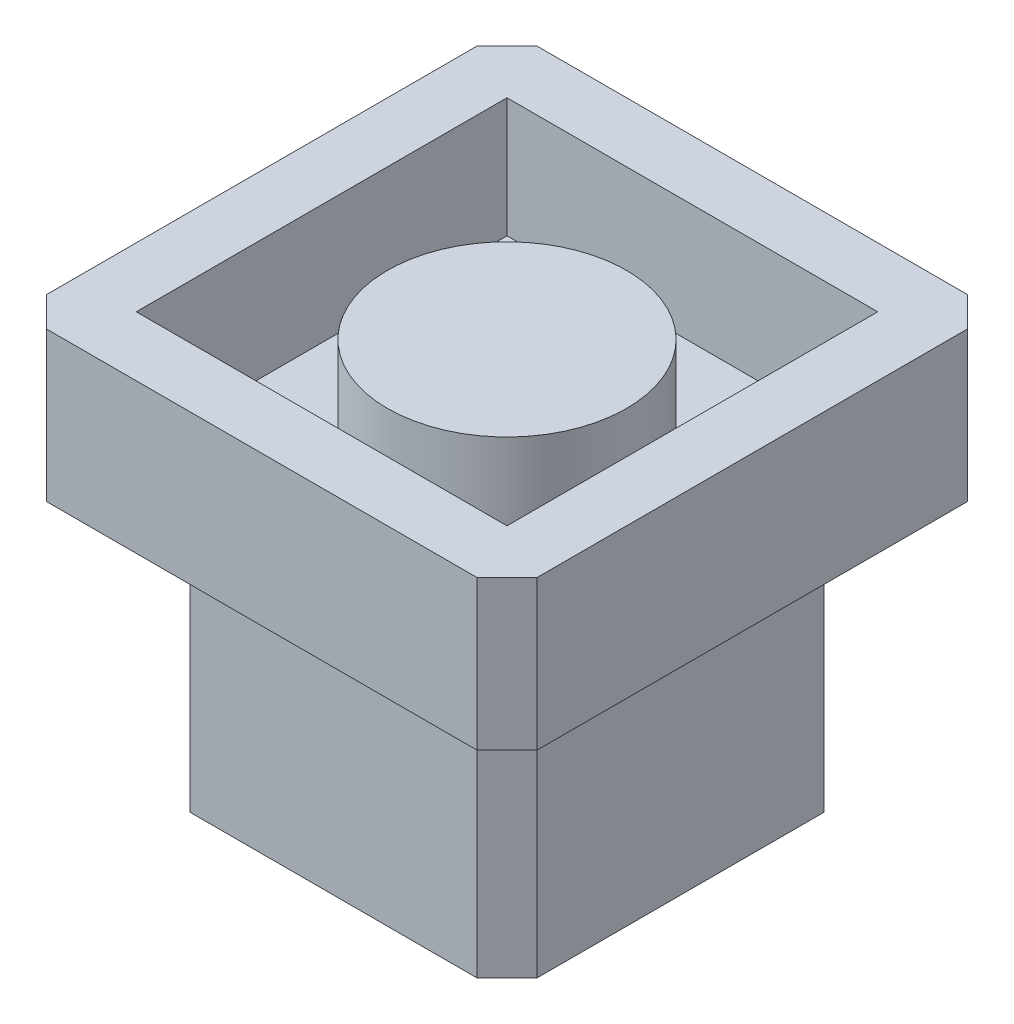
from build123d import *

# Parameters (mm, degrees)
SKETCH1_R           = 2
BOSS_EXTRUDE1_DEPTH = 1.6
SKETCH1_3_W         = 8.2
SKETCH1_3_H         = 8.2
SKETCH1_3_W_2       = 6.2
SKETCH1_3_H_2       = 6.2
BOSS_EXTRUDE2_DEPTH = 2
SKETCH1_4_W         = 8.2
SKETCH1_4_H         = 8.2
BOSS_EXTRUDE3_DEPTH = 0.5
SKETCH3_W           = 5.8
SKETCH3_H           = 5.8
BOSS_EXTRUDE4_DEPTH = 4.5
CHAMFER1_SIZE       = 0.5
CUT_EXTRUDE1_DEPTH  = 0.2


with BuildPart() as part:
    # Sketch1 → Boss-Extrude1 (new body)
    with BuildSketch(Plane(origin=(0, 0, 0), x_dir=(1, 0, 0), z_dir=(0, 1, 0))):
        Circle(SKETCH1_R)
    extrude(amount=BOSS_EXTRUDE1_DEPTH)



with BuildPart() as body_2:
    # Sketch1<3> → Boss-Extrude2 (new body)
    with BuildSketch(Plane(origin=(0, 0, 0), x_dir=(1, 0, 0), z_dir=(0, 1, 0))):
        Rectangle(SKETCH1_3_W, SKETCH1_3_H)
        Rectangle(SKETCH1_3_W_2, SKETCH1_3_H_2, mode=Mode.SUBTRACT)
    extrude(amount=BOSS_EXTRUDE2_DEPTH)


with BuildPart() as part_1:
    add(part.part)

    add(body_2.part)  # Boss-Extrude3 merges body 2
    # Sketch1<4> → Boss-Extrude3 (add)
    with BuildSketch(Plane(origin=(0, 0, 0), x_dir=(1, 0, 0), z_dir=(0, 1, 0))):
        Rectangle(SKETCH1_4_W, SKETCH1_4_H)
    extrude(amount=-BOSS_EXTRUDE3_DEPTH)

    # Sketch3 → Boss-Extrude4 (add)
    with BuildSketch(Plane.XZ.offset(0.5)):
        Rectangle(SKETCH3_W, SKETCH3_H)
    extrude(amount=BOSS_EXTRUDE4_DEPTH)

    # Chamfer1
    chamfer1_edges = [part_1.edges().sort_by_distance(p)[0] for p in [
        (-4.1, 0.75, -4.1),
        (4.1, 0.75, -4.1),
        (-4.1, 0.75, 4.1),
        (4.1, 0.75, 4.1),
        (-2.9, -2.75, 2.9),
        (2.9, -2.75, 2.9),
        (-2.9, -2.75, -2.9),
        (2.9, -2.75, -2.9),
    ]]
    chamfer(chamfer1_edges, length=CHAMFER1_SIZE)

    # Sketch4 → Cut-Extrude1 (cut)
    with BuildSketch(Plane.XZ.offset(5)):
        with BuildLine():
            Line((1.673414591, 1.219479822), (1.398574847, 1.009143283))
            add(Edge.make_bspline(
                [(1.398574847, 1.009143283), (1.378968959, 1.032509253), (1.340021512, 1.078926169), (1.27736231, 1.144105713), (1.212060667, 1.205170975), (1.144141545, 1.262412854), (1.072382426, 1.31382962), (0.998521627, 1.362100723), (0.921323582, 1.405368461), (0.814571847, 1.457831447), (0.674923999, 1.512577602), (0.49912916, 1.558480834), (0.315618062, 1.587702009), (0.190420462, 1.590866851), (0.126739911, 1.592476617)],
                knots=[0, 0, 0, 0, 0.757959112, 1.505699292, 2.245454638, 2.979532153, 3.711538275, 4.438200793, 5.171680507, 5.909471876, 7.393775596, 8.890124382, 10.418191784, 12, 12, 12, 12], degree=3))
            add(Edge.make_bspline(
                [(0.126739911, 1.592476617), (0.091656612, 1.592072654), (0.021815619, 1.591268478), (-0.081832854, 1.580659353), (-0.183545905, 1.565748143), (-0.283257371, 1.54362282), (-0.38084033, 1.515650201), (-0.476932732, 1.482224787), (-0.570143332, 1.440869947), (-0.66176157, 1.395161687), (-0.749540781, 1.343534242), (-0.832595829, 1.28722089), (-0.910623797, 1.226851794), (-0.983686409, 1.162200688), (-1.051858357, 1.093558727), (-1.114645668, 1.020194386), (-1.171831078, 0.942342212), (-1.224548103, 0.861028804), (-1.271760837, 0.776491013), (-1.311290716, 0.688415942), (-1.346295838, 0.598311839), (-1.373995081, 0.505160679), (-1.395919598, 0.409617913), (-1.411047261, 0.311427125), (-1.421535732, 0.210793445), (-1.422335909, 0.142584133), (-1.422739255, 0.108201777)],
                knots=[0, 0, 0, 0, 1.054917814, 2.100044995, 3.131103042, 4.146048494, 5.169673617, 6.183595914, 7.203665975, 8.234915748, 9.262203917, 10.264457458, 11.251630812, 12.227803204, 13.197192746, 14.159520551, 15.12972552, 16.100847026, 17.073214652, 18.039054194, 19.002613845, 19.979014051, 20.95965708, 21.949030935, 22.966165397, 24, 24, 24, 24], degree=3))
            add(Edge.make_bspline(
                [(-1.422739255, 0.108201777), (-1.421477436, 0.056470457), (-1.419000022, -0.045097128), (-1.396951688, -0.193867738), (-1.363446597, -0.336388412), (-1.31323102, -0.471768254), (-1.251311969, -0.601676612), (-1.173071358, -0.723915466), (-1.08245482, -0.84033203), (-0.978180401, -0.948174978), (-0.863774585, -1.046688703), (-0.741026673, -1.133439285), (-0.610242385, -1.205754167), (-0.472865755, -1.265930114), (-0.327839641, -1.312186842), (-0.175424839, -1.344750965), (-0.015952844, -1.365993146), (0.093016556, -1.368026834), (0.148474687, -1.369061845)],
                knots=[0, 0, 0, 0, 1.029171465, 2.020641659, 2.987623507, 3.938342917, 4.889210282, 5.84687017, 6.821220943, 7.821438502, 8.827599549, 9.822697543, 10.807740252, 11.797342354, 12.80366471, 13.83203677, 14.896651826, 16, 16, 16, 16], degree=3))
            add(Edge.make_bspline(
                [(0.148474687, -1.369061845), (0.209577376, -1.367373065), (0.329842085, -1.364049143), (0.506210111, -1.335889893), (0.675045877, -1.290231976), (0.836358463, -1.226334053), (0.98969311, -1.143268765), (1.13528977, -1.042570888), (1.27327134, -0.923282555), (1.356242623, -0.832199427), (1.398574847, -0.785728511)],
                knots=[0, 0, 0, 0, 1.028121516, 2.023589091, 2.998037872, 3.967518031, 4.937445131, 5.927275754, 6.942489185, 8, 8, 8, 8], degree=3))
            Line((1.398574847, -0.785728511), (1.673414591, -0.993961685))
            add(Edge.make_bspline(
                [(1.673414591, -0.993961685), (1.651296481, -1.022500136), (1.607166206, -1.079440343), (1.535708189, -1.159712052), (1.460430891, -1.235216088), (1.380775181, -1.305343709), (1.29765739, -1.371498175), (1.209585077, -1.431800006), (1.117716045, -1.48709089), (1.022361566, -1.537717815), (0.923622953, -1.582635062), (0.821618518, -1.62108883), (0.716787943, -1.654213719), (0.609126434, -1.681465656), (0.498410678, -1.70273674), (0.385040203, -1.716956415), (0.268770328, -1.726698329), (0.190328907, -1.727586245), (0.150578052, -1.728036204)],
                knots=[0, 0, 0, 0, 0.986787822, 1.968848986, 2.935600012, 3.899624008, 4.868462664, 5.837806735, 6.815139263, 7.798259679, 8.787526145, 9.778297419, 10.776456485, 11.791383307, 12.812564526, 13.85620153, 14.913611965, 16, 16, 16, 16], degree=3))
            add(Edge.make_bspline(
                [(0.150578052, -1.728036204), (0.112934385, -1.727774211), (0.038498695, -1.727256153), (-0.071400056, -1.718863986), (-0.178389637, -1.707414249), (-0.282164263, -1.690174118), (-0.383290238, -1.669829778), (-0.480850823, -1.642558521), (-0.575806033, -1.612009355), (-0.667774374, -1.576104368), (-0.756834073, -1.535588185), (-0.842697885, -1.489796627), (-0.925326317, -1.439114762), (-1.005531738, -1.384659751), (-1.082129322, -1.32468245), (-1.155782847, -1.260015815), (-1.226905323, -1.190877804), (-1.270908008, -1.141022951), (-1.293031723, -1.115956877)],
                knots=[0, 0, 0, 0, 1.114604814, 2.203992996, 3.262667896, 4.300477797, 5.318619304, 6.316056647, 7.298880507, 8.271930387, 9.238335007, 10.195173496, 11.151986948, 12.108099108, 13.064862484, 14.031167946, 15.010108607, 16, 16, 16, 16], degree=3))
            add(Edge.make_bspline(
                [(-1.293031723, -1.115956877), (-1.328467367, -1.072415688), (-1.398910844, -0.985858978), (-1.489036527, -0.845572996), (-1.566184082, -0.699104787), (-1.628560003, -0.545684859), (-1.677322736, -0.385657471), (-1.711103931, -0.218941957), (-1.733055536, -0.045694015), (-1.735565825, 0.072142774), (-1.736841819, 0.132039918)],
                knots=[0, 0, 0, 0, 0.994628077, 1.977248131, 2.950237994, 3.925870899, 4.908910175, 5.911660606, 6.938484602, 8, 8, 8, 8], degree=3))
            add(Edge.make_bspline(
                [(-1.736841819, 0.132039918), (-1.735286626, 0.194995372), (-1.73222688, 0.318856296), (-1.706231084, 0.500630249), (-1.664412288, 0.674781648), (-1.605015399, 0.840985393), (-1.529710048, 1.000115673), (-1.436683434, 1.150956878), (-1.327016292, 1.294473678), (-1.201568724, 1.428488429), (-1.064001389, 1.551027782), (-0.916682575, 1.658833985), (-0.759900628, 1.748551501), (-0.595382776, 1.823547664), (-0.421897095, 1.881192127), (-0.239813726, 1.921545313), (-0.049474811, 1.94666243), (0.080387615, 1.949837638), (0.146371322, 1.951450976)],
                knots=[0, 0, 0, 0, 1.032925535, 2.032216505, 3.007276963, 3.968222605, 4.92396291, 5.891752235, 6.871517503, 7.883894988, 8.900124299, 9.891468569, 10.874487609, 11.85992873, 12.854644235, 13.869047385, 14.917252991, 16, 16, 16, 16], degree=3))
            add(Edge.make_bspline(
                [(0.146371322, 1.951450976), (0.186585794, 1.950968838), (0.266186291, 1.950014494), (0.383938943, 1.940708351), (0.49858127, 1.925194745), (0.610192252, 1.904078675), (0.719314868, 1.877871354), (0.825115109, 1.843731056), (0.928213796, 1.804694524), (1.027960704, 1.759736058), (1.123877255, 1.709269317), (1.215933573, 1.653853693), (1.303398432, 1.593557888), (1.38688728, 1.528894712), (1.465003491, 1.458496153), (1.53996497, 1.384298557), (1.609226048, 1.304164733), (1.651979243, 1.247759799), (1.673414591, 1.219479822)],
                knots=[0, 0, 0, 0, 1.096760587, 2.17092713, 3.219439832, 4.250915756, 5.268269357, 6.278326846, 7.281116186, 8.274029601, 9.260640565, 10.235837813, 11.203064059, 12.156899882, 13.114053108, 14.069676657, 15.032185724, 16, 16, 16, 16], degree=3))
        make_face()
    extrude(amount=-CUT_EXTRUDE1_DEPTH, mode=Mode.SUBTRACT)


solid = part_1.part
